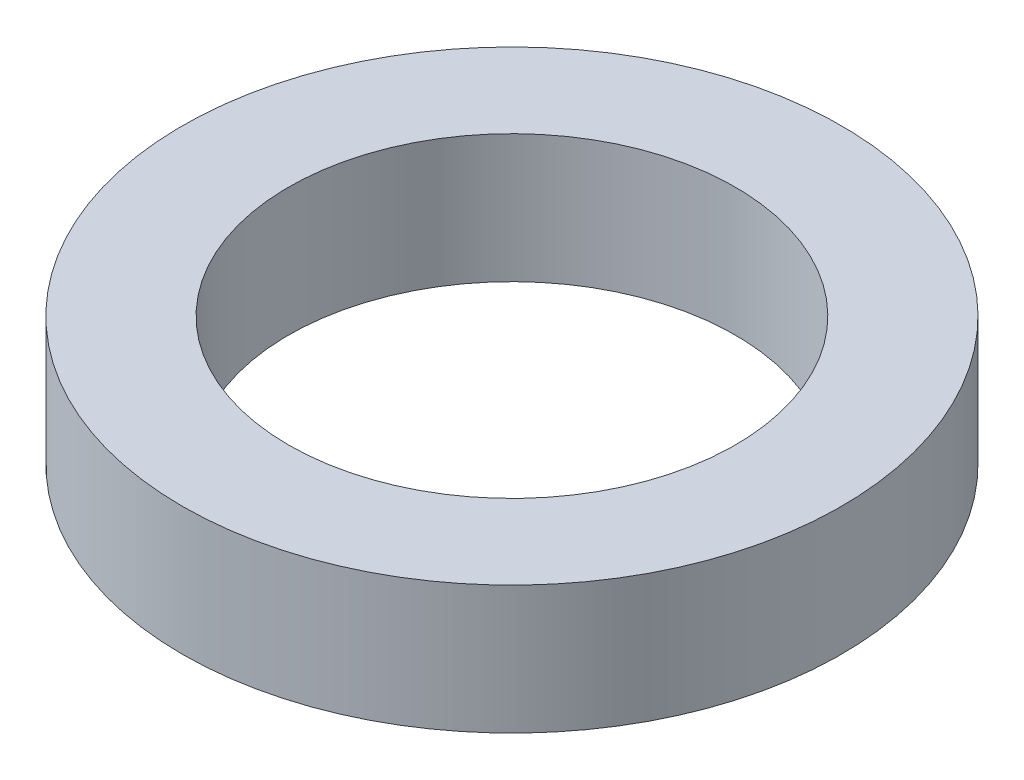
from build123d import *

# Parameters (mm, degrees)
SPACER_STOCK_SKETCH_R           = 9
SPACER_STOCK_DEPTH              = 3.5
AXLE_RUNNING_CLEARANCE_SKETCH_R = 6.1
AXLE_RUNNING_CLEARANCE_DEPTH    = 3.7


with BuildPart() as part:
    # Spacer stock sketch → Spacer stock (new body)
    with BuildSketch(Plane(origin=(0, -240.5, 0), x_dir=(1, 0, 0), z_dir=(0, 1, 0))):
        with Locations(Location((-19.009182883, 53.244882879, 0), (0, 0, 270))):
            Circle(SPACER_STOCK_SKETCH_R)
    extrude(amount=SPACER_STOCK_DEPTH)

    # Axle running clearance sketch → Axle running clearance (cut)
    with BuildSketch(Plane(origin=(0, -240.6, 0), x_dir=(1, 0, 0), z_dir=(0, 1, 0))):
        with Locations(Location((-19.009182883, 53.244882879, 0), (0, 0, 270))):
            Circle(AXLE_RUNNING_CLEARANCE_SKETCH_R)
    extrude(amount=AXLE_RUNNING_CLEARANCE_DEPTH, mode=Mode.SUBTRACT)


solid = part.part
